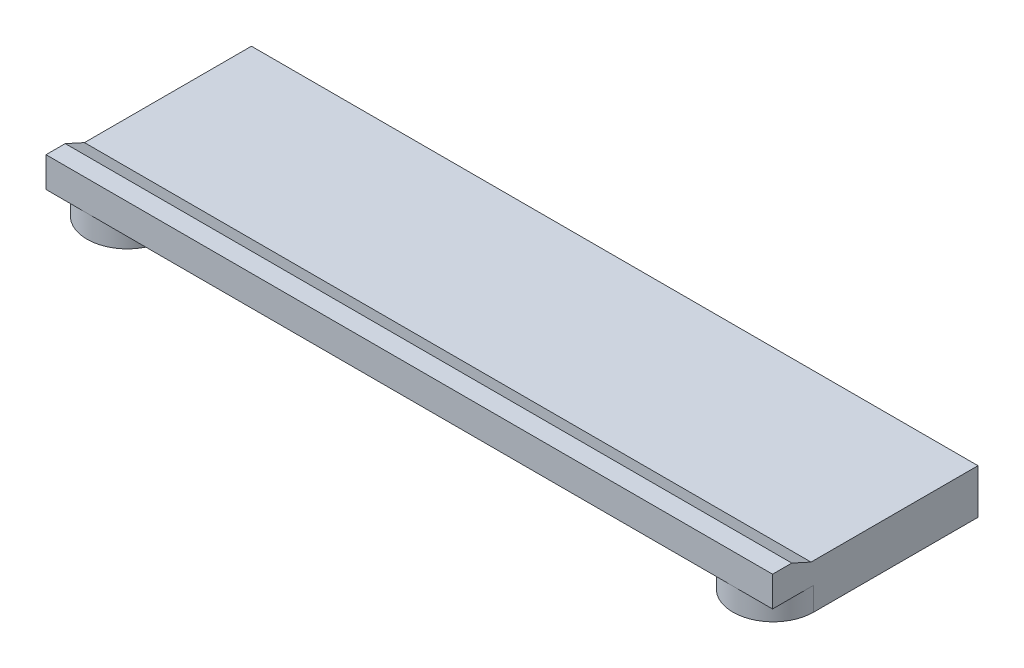
from build123d import *

# Parameters (mm, degrees)
CROQUIS1_W              = 747.21
CROQUIS1_H              = 211.28
SALIENTE_EXTRUIR1_DEPTH = 22
SALIENTE_EXTRUIR6_DEPTH = 39


with BuildPart() as part:
    # Croquis1 → Saliente-Extruir1 (new body)
    with BuildSketch(Plane(origin=(0, 0, 0), x_dir=(1, 0, 0), z_dir=(0, 1, 0))):
        with Locations((318.109210015, -105.64)):
            Rectangle(CROQUIS1_W, CROQUIS1_H)
    extrude(amount=SALIENTE_EXTRUIR1_DEPTH)

    # Croquis2 → Recubrir1 section 0
    with BuildSketch(Plane(origin=(0, 22, 0), x_dir=(1, 0, 0), z_dir=(0, 1, 0))):
        with BuildLine():
            Line((-55.495789985, -171.71895061), (-55.495789985, -211.28))
            Line((-55.495789985, -211.28), (691.714210015, -211.28))
            Line((691.714210015, -211.28), (691.714210015, -171.71895061))
            Line((691.714210015, -171.71895061), (-55.495789985, -171.71895061))
        make_face()
    # Croquis3 → Recubrir1 section 1
    with BuildSketch(Plane(origin=(0, 31, 0), x_dir=(1, 0, 0), z_dir=(0, 1, 0))):
        with BuildLine():
            Line((-55.495789985, -211.28), (-55.495789985, -191.499475305))
            Line((-55.495789985, -191.499475305), (691.714210015, -191.499475305))
            Line((691.714210015, -191.499475305), (691.714210015, -211.28))
            Line((691.714210015, -211.28), (-55.495789985, -211.28))
        make_face()
    loft()

    # Croquis4 → Saliente-Extruir6 (add)
    with BuildSketch(Plane(origin=(0, -24, 0), x_dir=(-1, 0, 0), z_dir=(0, -1, 0))):
        with BuildLine():
            Line((-691.714210015, 0), (-608.79118576, 0))
            Line((-608.79118576, 0), (-608.79118576, -169.061248366))
            ThreePointArc((-608.79118576, -169.061248366), (-650.252697887, -210.522760493), (-691.714210015, -169.061248366))
            Line((-691.714210015, -169.061248366), (-691.714210015, 0))
        make_face()
        with BuildLine():
            Line((55.495789985, 0), (55.495789985, -169.06124837))
            ThreePointArc((55.495789985, -169.06124837), (14.034277855, -210.5227605), (-27.427234275, -169.06124837))
            Line((-27.427234275, -169.06124837), (-26.075334487, -168.034902921))
            Line((-26.075334487, -168.034902921), (-27.427234275, 0))
            Line((-27.427234275, 0), (55.495789985, 0))
        make_face()
    extrude(amount=-SALIENTE_EXTRUIR6_DEPTH)


solid = part.part
